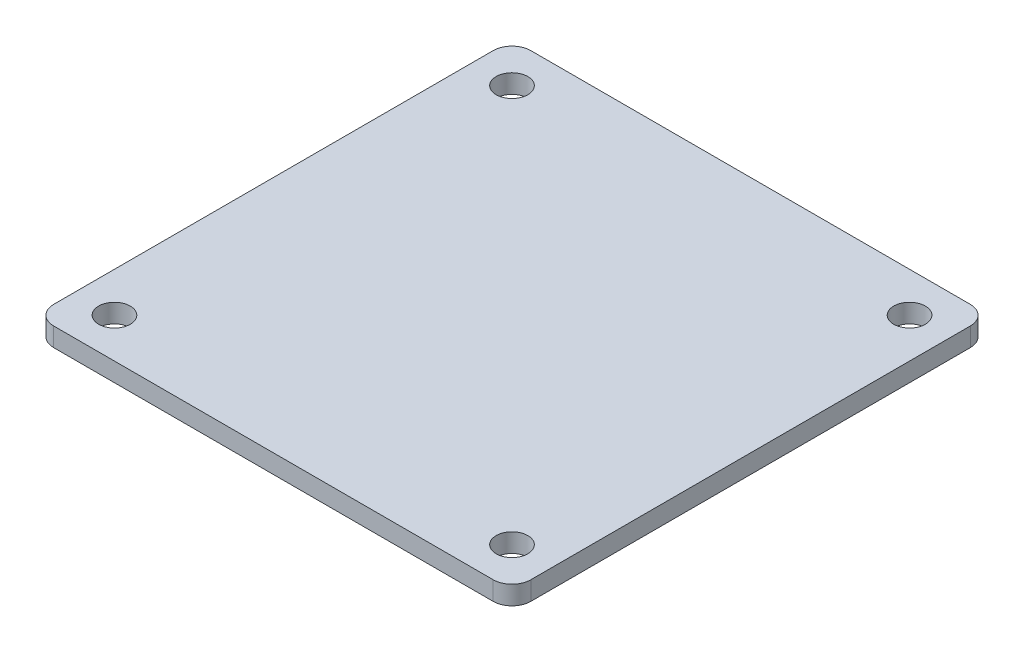
from build123d import *

# Parameters (mm, degrees)
SKETCH1_W           = 76.2
SKETCH1_H           = 76.2
SKETCH1_R           = 2.525
BOSS_EXTRUDE1_DEPTH = 3
FILLET1_R           = 3


with BuildPart() as part:
    # Sketch1 → Boss-Extrude1 (new body)
    with BuildSketch(Plane(origin=(0, 0, 0), x_dir=(1, 0, 0), z_dir=(0, 1, 0))):
        Rectangle(SKETCH1_W, SKETCH1_H)
        with Locations(Location((-31.75, 31.75, 0), (0, 0, 270))):
            Circle(SKETCH1_R, mode=Mode.SUBTRACT)
        with Locations(Location((31.75, 31.75, 0), (0, 0, 270))):
            Circle(SKETCH1_R, mode=Mode.SUBTRACT)
        with Locations(Location((31.75, -31.75, 0), (0, 0, 270))):
            Circle(SKETCH1_R, mode=Mode.SUBTRACT)
        with Locations(Location((-31.75, -31.75, 0), (0, 0, 270))):
            Circle(SKETCH1_R, mode=Mode.SUBTRACT)
    extrude(amount=BOSS_EXTRUDE1_DEPTH)

    # Fillet1
    fillet1_edges = [part.edges().sort_by_distance(p)[0] for p in [
        (38.1, 1.5, 38.1),
        (-38.1, 1.5, 38.1),
        (-38.1, 1.5, -38.1),
        (38.1, 1.5, -38.1),
    ]]
    fillet(fillet1_edges, radius=FILLET1_R)


solid = part.part
